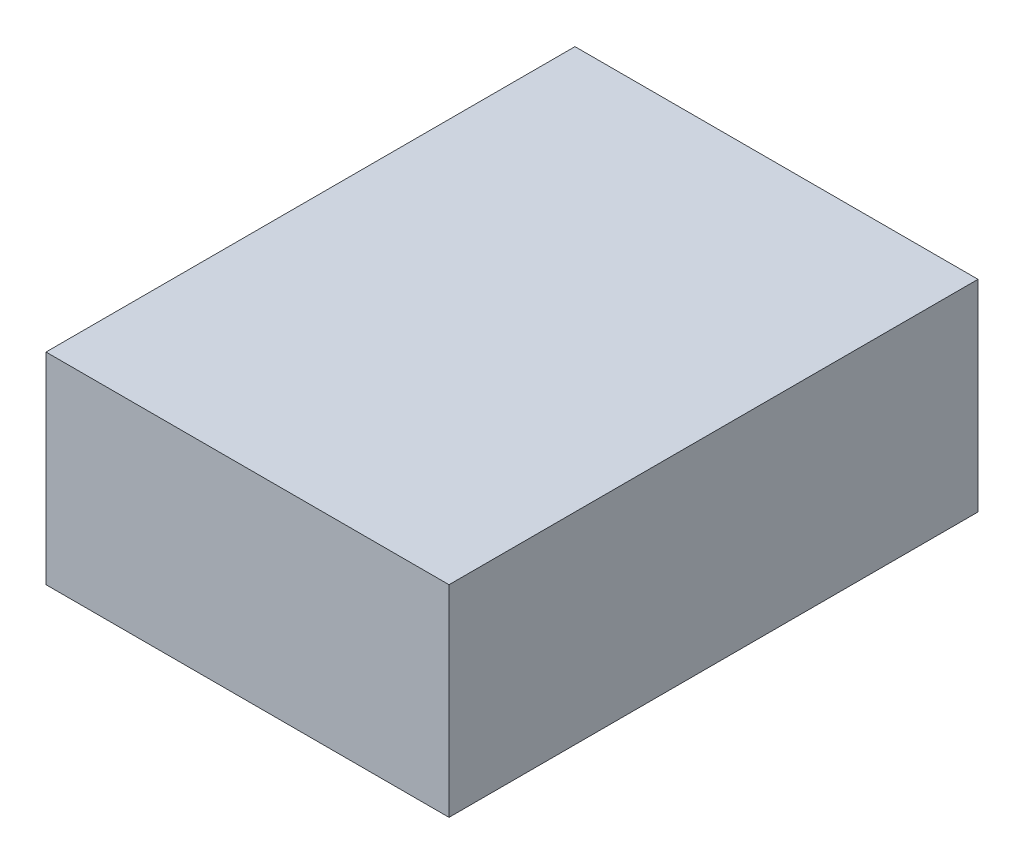
from build123d import *

# Parameters (mm, degrees)
SKETCH2_W           = 101.6
SKETCH2_H           = 50.8
BOSS_EXTRUDE1_DEPTH = 133.35


with BuildPart() as part:
    # Sketch2 → Boss-Extrude1 (new body)
    with BuildSketch(Plane.XY):
        with Locations((50.8, 25.4)):
            Rectangle(SKETCH2_W, SKETCH2_H)
    extrude(amount=BOSS_EXTRUDE1_DEPTH)


solid = part.part
